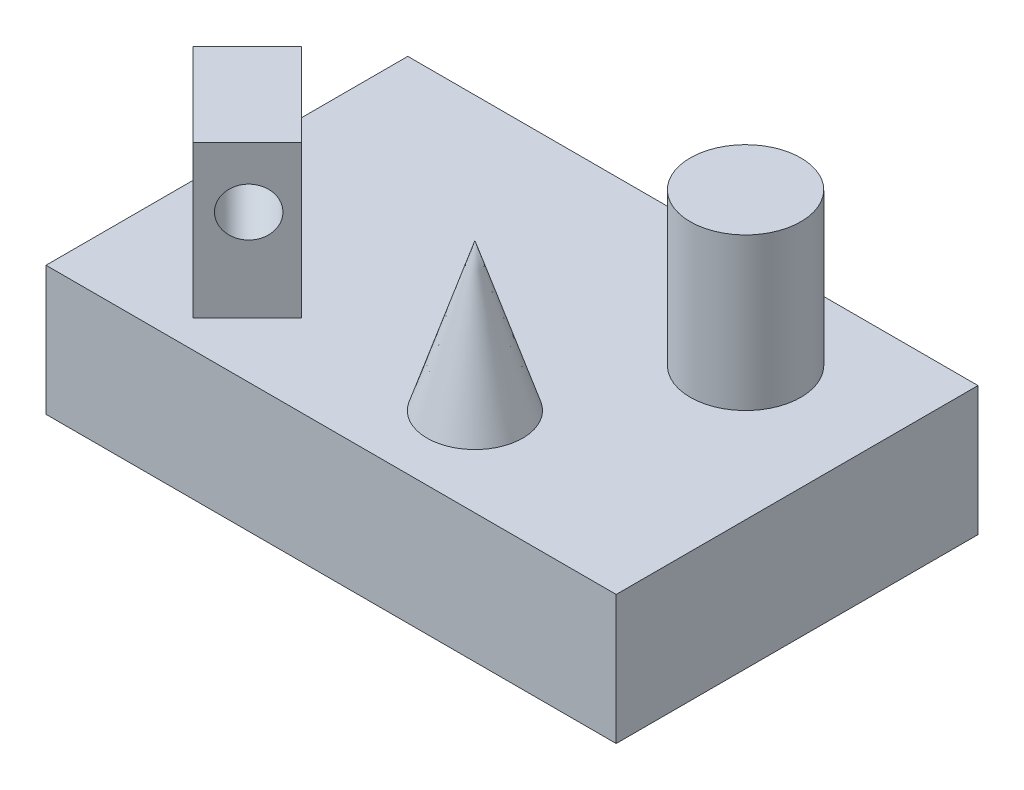
from build123d import *

# Parameters (mm, degrees)
SCHIZZO1_W                    = 56.23046985
SCHIZZO1_H                    = 35.680874005
ESTRUSIONE_ESTRUSIONE1_DEPTH  = 12.735315729
ESTRUSIONE_ESTRUSIONE2_DEPTH  = 15
SCHIZZO3_R                    = 5.453750666
ESTRUSIONE_ESTRUSIONE3_DEPTH  = 15
TAGLIO_ESTRUSIONE1_DEPTH      = 72.131882913
TAGLIO_ESTRUSIONE1_DEPTH_BACK = 72.131882913
SCHIZZO5_R                    = 2.388711944


with BuildPart() as part:
    # Schizzo1 → Estrusione-Estrusione1 (new body)
    with BuildSketch(Plane(origin=(0, 0, 0), x_dir=(1, 0, 0), z_dir=(0, 1, 0))):
        with Locations((28.115234925, 17.840437002)):
            Rectangle(SCHIZZO1_W, SCHIZZO1_H)
    extrude(amount=ESTRUSIONE_ESTRUSIONE1_DEPTH)


with BuildPart() as body_2:
    # Schizzo2 → Estrusione-Estrusione2 (new body)
    with BuildSketch(Plane(origin=(0, 12.735315729, 0), x_dir=(1, 0, 0), z_dir=(0, 1, 0))):
        Polygon((3.572563991, 10.94212636), (8.922368061, 16.29193043), (17.109189441, 8.10510905), (11.759385371, 2.75530498), align=None)
    extrude(amount=ESTRUSIONE_ESTRUSIONE2_DEPTH)

    # Schizzo5 → Taglio-Estrusione1 (cut, two sides: drawn at the far end of the back side and taken through both)
    with BuildSketch(Plane(origin=(4.502040195, 0, 4.502040195), x_dir=(0.7071067811865465, 0, -0.7071067811865487), z_dir=(0.7071067811865487, 0, 0.7071067811865465)).offset(-TAGLIO_ESTRUSIONE1_DEPTH_BACK)):
        with Locations((14.135013801, 21.77630268)):
            Circle(SCHIZZO5_R)
    extrude(amount=TAGLIO_ESTRUSIONE1_DEPTH + TAGLIO_ESTRUSIONE1_DEPTH_BACK, mode=Mode.SUBTRACT)


with BuildPart() as body_3:
    # Schizzo3 → Estrusione-Estrusione3 (new body)
    with BuildSketch(Plane(origin=(0, 12.735315729, 0), x_dir=(1, 0, 0), z_dir=(0, 1, 0))):
        with Locations(Location((43.051598553, 25.936783642, 0), (0, 0, 270))):
            Circle(SCHIZZO3_R)
    extrude(amount=ESTRUSIONE_ESTRUSIONE3_DEPTH)


with BuildPart() as body_4:
    # Estrusione-Estrusione4 cone 1 section (through the dimple's axis) → Estrusione-Estrusione4 (revolve)
    with BuildSketch(Plane(origin=(33.559330079, 12.735315729, -8.739026642), x_dir=(0, 0, -1), z_dir=(1, 0, 0))):
        Polygon((0, 0), (4.717141892, 0), (0, 14.517869944), align=None)
    revolve(axis=Axis((33.559330079, 12.735315729, -8.739026642), (0, 1, 0)))


solid = Compound([part.part, body_2.part, body_3.part, body_4.part])
